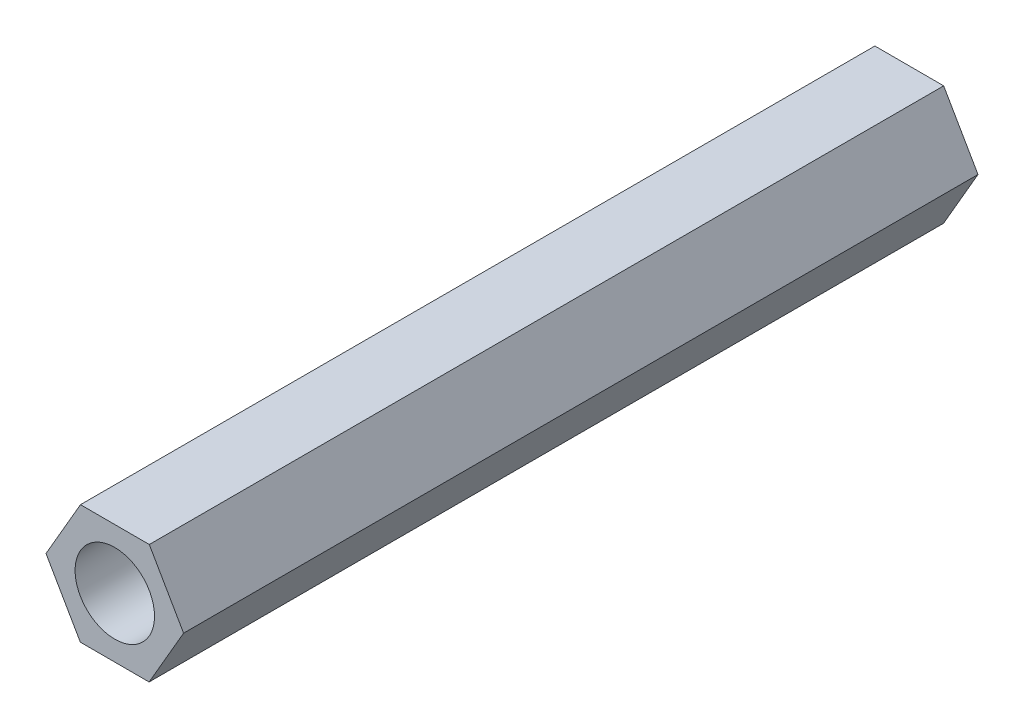
from build123d import *

# Parameters (mm, degrees)
SKETCH2_R           = 3
SKETCH2_R_2         = 2
BOSS_EXTRUDE1_DEPTH = 40


with BuildPart() as part:
    # Sketch2 → Boss-Extrude1 (new body)
    # profile 1 of 7: a face of its own
    with BuildSketch(Plane.XY):
        Circle(SKETCH2_R)
        Circle(SKETCH2_R_2, mode=Mode.SUBTRACT)
    # profile 2 of 7: a face of its own
    with BuildSketch(Plane.XY):
        with BuildLine():
            Line((0.00424563, 2.999996996), (-1.7278037, 3.002448064))
            Line((-1.7278037, 3.002448064), (-2.595950792, 1.503675326))
            ThreePointArc((-2.595950792, 1.503675326), (-1.496321672, 2.600196426), (0.00424563, 2.999996996))
        make_face()
    # profile 3 of 7: a face of its own
    with BuildSketch(Plane.XY):
        with BuildLine():
            Line((1.736294447, 2.997545929), (0.00424563, 2.999996996))
            ThreePointArc((0.00424563, 2.999996996), (1.503675324, 2.595950793), (2.600196428, 1.496321669))
            Line((2.600196428, 1.496321669), (1.736294447, 2.997545929))
        make_face()
    # profile 4 of 7: a face of its own
    with BuildSketch(Plane.XY):
        with BuildLine():
            Line((3.464098147, -0.004902135), (2.600196428, 1.496321669))
            ThreePointArc((2.600196428, 1.496321669), (2.898326179, 0.774406456), (3, 0))
            ThreePointArc((3, 0), (2.897227326, -0.778507431), (2.595950787, -1.503675335))
            Line((2.595950787, -1.503675335), (3.464098147, -0.004902135))
        make_face()
    # profile 5 of 7: a face of its own
    with BuildSketch(Plane.XY):
        with BuildLine():
            ThreePointArc((2.595950787, -1.503675335), (1.496321666, -2.60019643), (-0.004245634, -2.999996996))
            Line((-0.004245634, -2.999996996), (1.7278037, -3.002448064))
            Line((1.7278037, -3.002448064), (2.595950787, -1.503675335))
        make_face()
    # profile 6 of 7: a face of its own
    with BuildSketch(Plane.XY):
        with BuildLine():
            ThreePointArc((-0.004245634, -2.999996996), (-1.503675323, -2.595950794), (-2.600196425, -1.496321674))
            Line((-2.600196425, -1.496321674), (-1.736294447, -2.997545929))
            Line((-1.736294447, -2.997545929), (-0.004245634, -2.999996996))
        make_face()
    # profile 7 of 7: a face of its own
    with BuildSketch(Plane.XY):
        with BuildLine():
            ThreePointArc((-2.600196425, -1.496321674), (-2.999996996, 0.004245633), (-2.595950792, 1.503675326))
            Line((-2.595950792, 1.503675326), (-3.464098147, 0.004902135))
            Line((-3.464098147, 0.004902135), (-2.600196425, -1.496321674))
        make_face()
    extrude(amount=BOSS_EXTRUDE1_DEPTH)


solid = part.part
